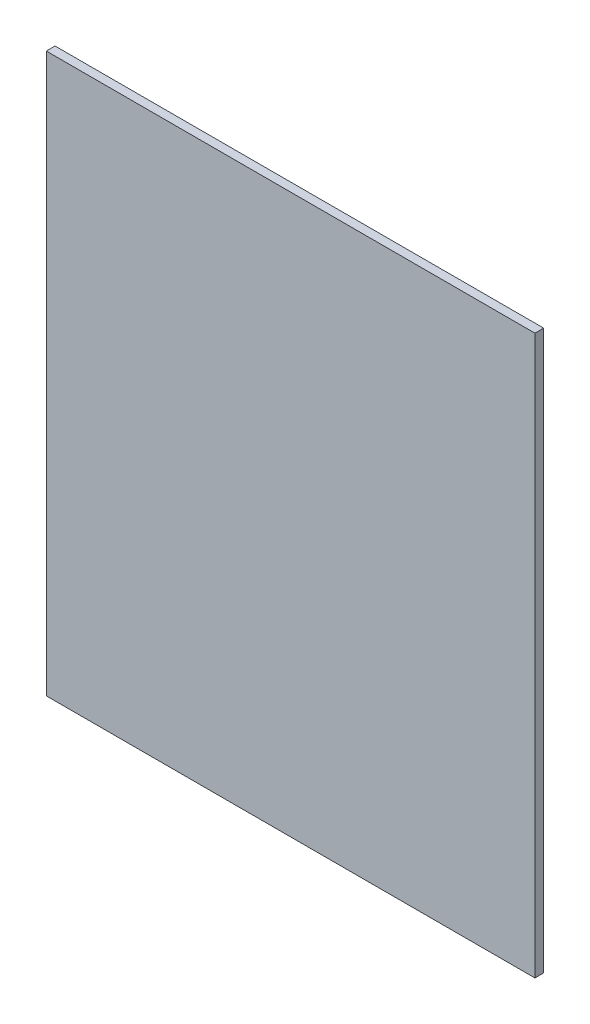
from build123d import *

# Parameters (mm, degrees)
SKETCH1_W           = 1066.8
SKETCH1_H           = 1219.2
BOSS_EXTRUDE1_DEPTH = 19.05


with BuildPart() as part:
    # Sketch1 → Boss-Extrude1 (new body)
    with BuildSketch(Plane.XY):
        Rectangle(SKETCH1_W, SKETCH1_H)
    extrude(amount=BOSS_EXTRUDE1_DEPTH)


solid = part.part
